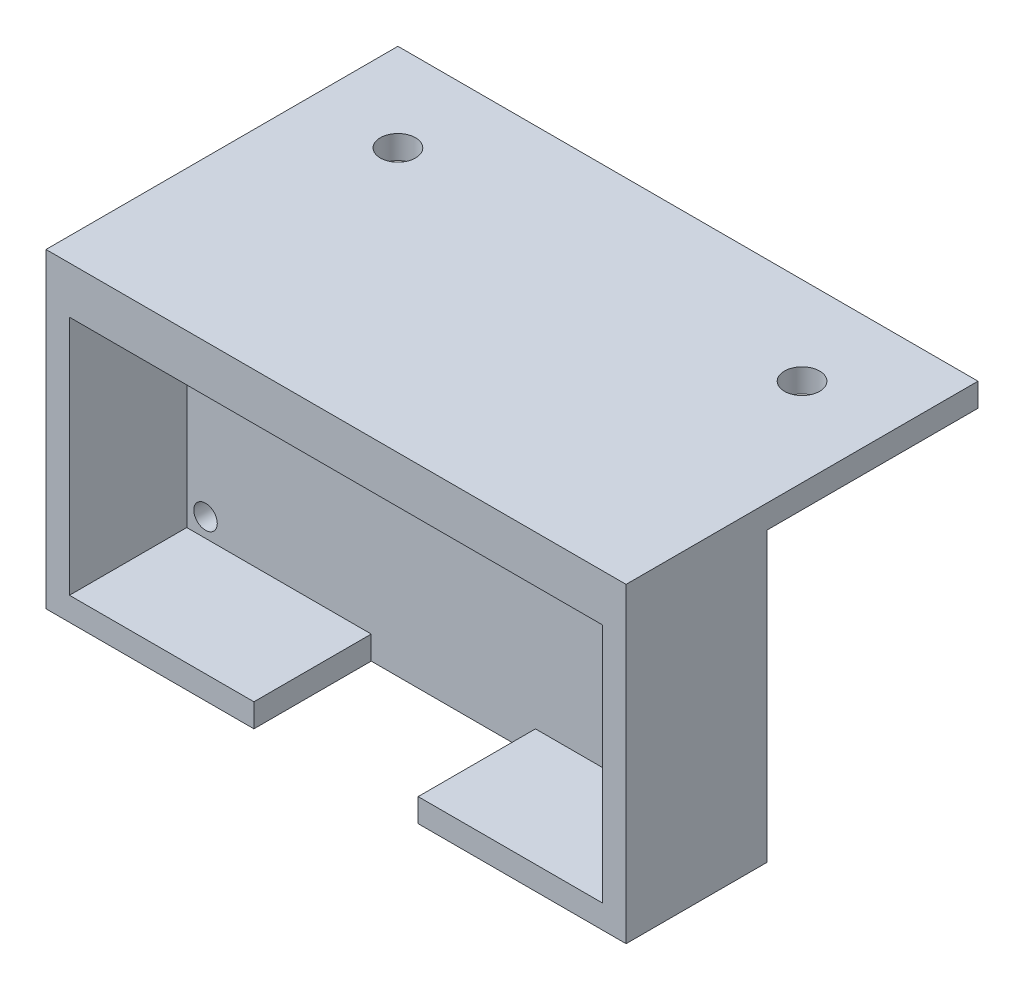
from build123d import *

# Parameters (mm, degrees)
BOSS_EXTRU_1_DEPTH      = 10
ESQUISSE2_W             = 49.45
ESQUISSE2_H             = 24.53
BOSS_EXTRU_2_DEPTH      = 2
ESQUISSE3_R             = 1
ENL_V_MAT_EXTRU_1_DEPTH = 2
ESQUISSE7_W             = 49.45
ESQUISSE7_H             = 30
BOSS_EXTRU_3_DEPTH      = 2
ESQUISSE8_R             = 1.5
ENL_V_MAT_EXTRU_2_DEPTH = 2


with BuildPart() as part:
    # Esquisse1 → Boss.-Extru.1 (new body)
    with BuildSketch(Plane.XY):
        Polygon((8.740819068, -15.001789588), (26.465819068, -15.001789588), (26.465819068, 9.528210412), (-22.984180932, 9.528210412), (-22.984180932, -15.001789588), (-5.259180932, -15.001789588), (-5.259180932, -13.001789588), (-20.984180932, -13.001789588), (-20.984180932, 7.528210412), (24.465819068, 7.528210412), (24.465819068, -13.001789588), (8.740819068, -13.001789588), align=None)
    extrude(amount=BOSS_EXTRU_1_DEPTH)

    # Esquisse2 → Boss.-Extru.2 (add)
    with BuildSketch(Plane(origin=(0, 0, 0), x_dir=(-1, 0, 0), z_dir=(0, 0, -1))):
        with Locations((-1.740819068, -2.736789588)):
            Rectangle(ESQUISSE2_W, ESQUISSE2_H)
    extrude(amount=BOSS_EXTRU_2_DEPTH)

    # Esquisse3 → Enlèv. mat.-Extru.1 (cut)
    with BuildSketch(Plane.XY):
        with Locations((-19.384180932, -11.401789588)):
            Circle(ESQUISSE3_R)
        with Locations(Location((22.865819068, -11.401789588, 0), (0, 0, 180))):
            Circle(ESQUISSE3_R)
        with Locations((22.865819068, 5.928210412)):
            Circle(ESQUISSE3_R)
        with Locations(Location((-19.384180932, 5.928210412, 0), (0, 0, 180))):
            Circle(ESQUISSE3_R)
    extrude(amount=-ENL_V_MAT_EXTRU_1_DEPTH, mode=Mode.SUBTRACT)

    # Esquisse7 → Boss.-Extru.3 (add)
    with BuildSketch(Plane(origin=(0, 9.528210412, 0), x_dir=(1, 0, 0), z_dir=(0, 1, 0))):
        with Locations((1.740819068, 5)):
            Rectangle(ESQUISSE7_W, ESQUISSE7_H)
    extrude(amount=BOSS_EXTRU_3_DEPTH)

    # Esquisse8 → Enlèv. mat.-Extru.2 (cut)
    with BuildSketch(Plane(origin=(0, 11.528210412, 0), x_dir=(1, 0, 0), z_dir=(0, 1, 0))):
        with Locations(Location((-15.484180932, 12.5, 0), (0, 0, 180))):
            Circle(ESQUISSE8_R)
        with Locations((18.965819068, 12.5)):
            Circle(ESQUISSE8_R)
    extrude(amount=-ENL_V_MAT_EXTRU_2_DEPTH, mode=Mode.SUBTRACT)


solid = part.part
